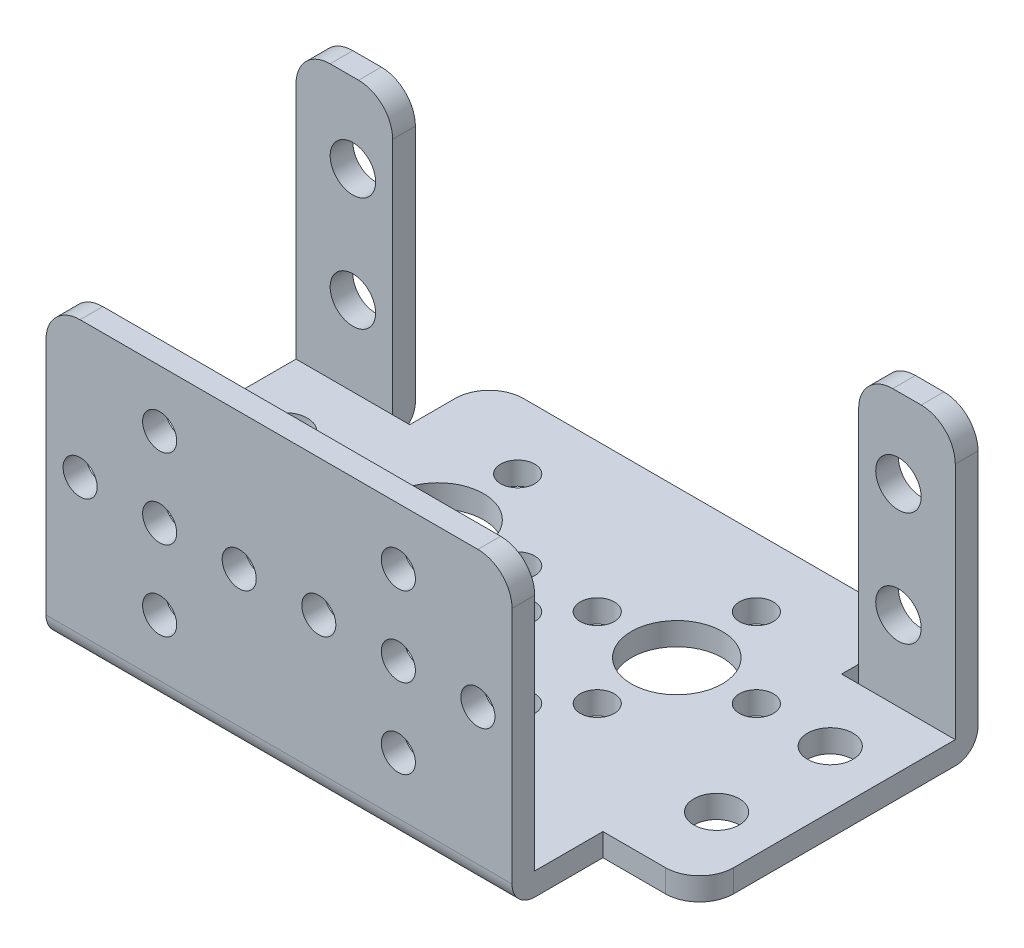
from build123d import *

# Parameters (mm, degrees)
SKETCH_2_R          = 2
SKETCH_2_R_2        = 1.5
SKETCH_2_R_3        = 4
EXTRUDE_1_DEPTH     = 2
SKETCH_1_W          = 58
SKETCH_1_H          = 2
SKETCH_1_W_2        = 8.5
EXTRUDE_2_DEPTH     = 24
SKETCH_3_R          = 2
CUT_EXTRUDE_1_DEPTH = 12
FILLET_1_R          = 3
SKETCH_4_R          = 1.5
CUT_EXTRUDE_2_DEPTH = 12
SKETCH_5_W          = 8.5
SKETCH_5_H          = 26
CUT_EXTRUDE_3_DEPTH = 8
FILLET_2_R          = 3
FILLET_3_R          = 2


with BuildPart() as part:
    # 草图2 → 凸台-拉伸1 (new body)
    with BuildSketch(Plane(origin=(0, 0, 0), x_dir=(1, 0, 0), z_dir=(0, 1, 0))):
        Polygon((-29, -18.75), (29, -18.75), (29, 13.75), (20.5, 13.75), (20.5, 11.75), (19, 11.75), (19, 18.75), (-19, 18.75), (-19, 11.75), (-20.5, 11.75), (-20.5, 13.75), (-29, 13.75), align=None)
        with BuildLine():
            ThreePointArc((0, -13.25), (-1.5, -11.75), (0, -10.25))
            ThreePointArc((0, -10.25), (1.5, -11.75), (0, -13.25))
        make_face(mode=Mode.SUBTRACT)
        with Locations((-24, -4.25)):
            Circle(SKETCH_2_R, mode=Mode.SUBTRACT)
        with Locations((-7, -4.75)):
            Circle(SKETCH_2_R_2, mode=Mode.SUBTRACT)
        with BuildLine():
            ThreePointArc((0, -8.75), (-4, -4.75), (0, -0.75))
            ThreePointArc((0, -0.75), (4, -4.75), (0, -8.75))
        make_face(mode=Mode.SUBTRACT)
        with Locations((-10.5, -1.25)):
            Circle(SKETCH_2_R_2, mode=Mode.SUBTRACT)
        with Locations((7, -4.75)):
            Circle(SKETCH_2_R_2, mode=Mode.SUBTRACT)
        with Locations((10.5, -1.25)):
            Circle(SKETCH_2_R_2, mode=Mode.SUBTRACT)
        with Locations((24, -4.25)):
            Circle(SKETCH_2_R, mode=Mode.SUBTRACT)
        with Locations((-24, 5.75)):
            Circle(SKETCH_2_R, mode=Mode.SUBTRACT)
        with Locations((-17.5, 5.75)):
            Circle(SKETCH_2_R_2, mode=Mode.SUBTRACT)
        with Locations((0, 2.25)):
            Circle(SKETCH_2_R_2, mode=Mode.SUBTRACT)
        with Locations((-10.5, 5.75)):
            Circle(SKETCH_2_R_3, mode=Mode.SUBTRACT)
        with Locations((-3.5, 5.75)):
            Circle(SKETCH_2_R_2, mode=Mode.SUBTRACT)
        with Locations((-10.5, 12.75)):
            Circle(SKETCH_2_R_2, mode=Mode.SUBTRACT)
        with Locations((3.5, 5.75)):
            Circle(SKETCH_2_R_2, mode=Mode.SUBTRACT)
        with Locations((10.5, 5.75)):
            Circle(SKETCH_2_R_3, mode=Mode.SUBTRACT)
        with Locations((17.5, 5.75)):
            Circle(SKETCH_2_R_2, mode=Mode.SUBTRACT)
        with Locations((24, 5.75)):
            Circle(SKETCH_2_R, mode=Mode.SUBTRACT)
        with Locations((10.5, 12.75)):
            Circle(SKETCH_2_R_2, mode=Mode.SUBTRACT)
    extrude(amount=-EXTRUDE_1_DEPTH)

    # 草图1 → 凸台-拉伸2 (add)
    with BuildSketch(Plane(origin=(0, 0, 0), x_dir=(1, 0, 0), z_dir=(0, 1, 0))):
        with Locations((0, -17.75)):
            Rectangle(SKETCH_1_W, SKETCH_1_H)
        with Locations((-24.75, 12.75)):
            Rectangle(SKETCH_1_W_2, SKETCH_1_H)
        with Locations((24.75, 12.75)):
            Rectangle(SKETCH_1_W_2, SKETCH_1_H)
    extrude(amount=EXTRUDE_2_DEPTH)

    # 草图3 → 切除-拉伸1 (cut)
    with BuildSketch(Plane(origin=(0, 0, -13.75), x_dir=(-1, 0, 0), z_dir=(0, 0, -1))):
        with Locations((-24, 17)):
            Circle(SKETCH_3_R)
        with Locations((24, 17)):
            Circle(SKETCH_3_R)
        with Locations((24, 7)):
            Circle(SKETCH_3_R)
        with Locations((-24, 7)):
            Circle(SKETCH_3_R)
    extrude(amount=-CUT_EXTRUDE_1_DEPTH, mode=Mode.SUBTRACT)

    # 圆角1
    fillet_1_edges = [part.edges().sort_by_distance(p)[0] for p in [
        (29, 24, -12.75),
        (20.5, 24, -12.75),
        (-20.5, 24, -12.75),
        (-29, 24, -12.75),
    ]]
    fillet(fillet_1_edges, radius=FILLET_1_R)

    # 草图4 → 切除-拉伸2 (cut)
    with BuildSketch(Plane.XY.offset(18.75)):
        with Locations((10.5, 12)):
            Circle(SKETCH_4_R)
        with Locations((-10.5, 12)):
            Circle(SKETCH_4_R)
        with Locations((-17.5, 12)):
            Circle(SKETCH_4_R)
        with Locations((-10.5, 19)):
            Circle(SKETCH_4_R)
        with Locations((-3.5, 12)):
            Circle(SKETCH_4_R)
        with Locations((-10.5, 5)):
            Circle(SKETCH_4_R)
        with Locations((17.5, 12)):
            Circle(SKETCH_4_R)
        with Locations((10.5, 5)):
            Circle(SKETCH_4_R)
        with Locations((3.5, 12)):
            Circle(SKETCH_4_R)
        with Locations((10.5, 19)):
            Circle(SKETCH_4_R)
    extrude(amount=-CUT_EXTRUDE_2_DEPTH, mode=Mode.SUBTRACT)

    # 草图5 → 切除-拉伸3 (cut)
    with BuildSketch(Plane.XY.offset(18.75)):
        with Locations((-24.75, 11)):
            Rectangle(SKETCH_5_W, SKETCH_5_H)
        with Locations((24.75, 11)):
            Rectangle(SKETCH_5_W, SKETCH_5_H)
    extrude(amount=-CUT_EXTRUDE_3_DEPTH, mode=Mode.SUBTRACT)

    # 圆角2
    fillet_2_edges = [part.edges().sort_by_distance(p)[0] for p in [
        (19, -1, -18.75),
        (-19, -1, -18.75),
        (-20.5, 24, 17.75),
        (20.5, 24, 17.75),
        (29, -1, 10.75),
        (-29, -1, 10.75),
    ]]
    fillet(fillet_2_edges, radius=FILLET_2_R)

    # 圆角3
    fillet_3_edges = [part.edges().sort_by_distance(p)[0] for p in [
        (0, -2, 18.75),
        (-24.75, -2, -13.75),
        (24.75, -2, -13.75),
    ]]
    fillet(fillet_3_edges, radius=FILLET_3_R)


solid = part.part
